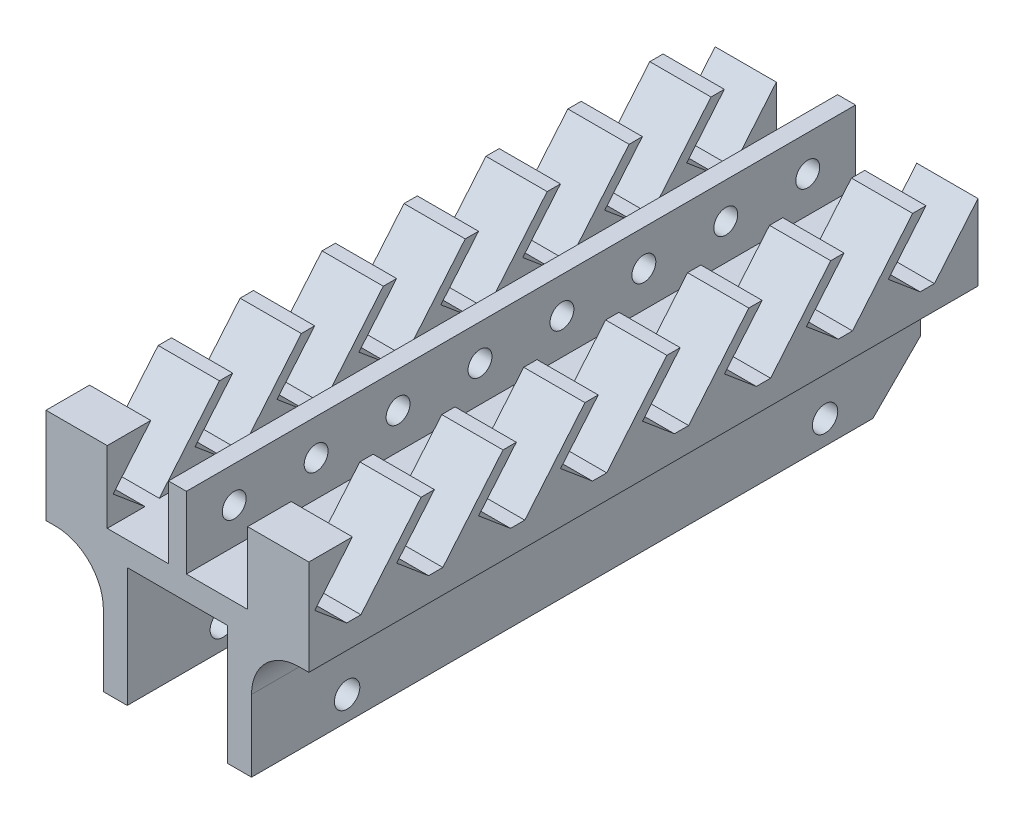
from build123d import *

# Parameters (mm, degrees)
BOSS_EXTRUDE1_DEPTH             = 88.9
F_1_4_CLEARANCE_HOLE1_D         = 6.7564
CHAMFER1_SIZE                   = 12.7
SKETCH8_W                       = 69.85
SKETCH8_H                       = 177.8
BOSS_EXTRUDE4_DEPTH             = 6.35
SKETCH4_W                       = 177.8
SKETCH4_H                       = 19.05
BOSS_EXTRUDE2_DEPTH             = 2.38125
F_1_4_0_25_DIAMETER_HOLE1_D     = 6.35
F_1_4_0_25_DIAMETER_HOLE1_DEPTH = 11.938
F_1_4_0_25_DIAMETER_HOLE1_TIP   = 1.907732465
FILLET3_R                       = 12.7
BOSS_EXTRUDE7_DEPTH             = 34.925
SKETCH31_W                      = 16.271875
SKETCH31_H                      = 19.05
CUT_EXTRUDE1_DEPTH              = 186.839234959


with BuildPart() as part:
    # Sketch1 → Boss-Extrude1 (new, symmetric)
    with BuildSketch(Plane.XY):
        Polygon((-19.685, 22.225), (19.685, 22.225), (19.685, -15.875), (13.335, -15.875), (13.335, 15.875), (-13.335, 15.875), (-13.335, -15.875), (-19.685, -15.875), align=None)
    extrude(amount=BOSS_EXTRUDE1_DEPTH, both=True)

    # 1/4 Clearance Hole1 (through all)
    with Locations(Plane(origin=(19.685, 0, 0), x_dir=(0, 0, -1), z_dir=(1, 0, 0))):
        with Locations((-63.5, -9.525), (63.5, -9.525)):
            Hole(F_1_4_CLEARANCE_HOLE1_D / 2)

    # Chamfer1
    chamfer1_edges = [part.edges().sort_by_distance(p)[0] for p in [
        (16.51, -15.875, -88.9),
        (-16.51, -15.875, -88.9),
    ]]
    chamfer(chamfer1_edges, length=CHAMFER1_SIZE)

    # Sketch8 → Boss-Extrude4 (add)
    with BuildSketch(Plane(origin=(0, 22.225, 0), x_dir=(1, 0, 0), z_dir=(0, 1, 0))):
        Rectangle(SKETCH8_W, SKETCH8_H)
    extrude(amount=-BOSS_EXTRUDE4_DEPTH)

    # Sketch4 → Boss-Extrude2 (add, symmetric)
    with BuildSketch(Plane(origin=(0, 0, 0), x_dir=(0, 0, -1), z_dir=(1, 0, 0))):
        with Locations((0, 31.75)):
            Rectangle(SKETCH4_W, SKETCH4_H)
    extrude(amount=BOSS_EXTRUDE2_DEPTH, both=True)

    # 1/4 (0.25) Diameter Hole1
    with Locations(Plane.ZY.offset(2.38125)):
        with Locations((-76.2, 31.75), (76.2, 31.75), (54.428571429, 31.75), (32.657142857, 31.75), (10.885714286, 31.75), (-10.885714286, 31.75), (-32.657142857, 31.75), (-54.428571429, 31.75)):
            Hole(F_1_4_0_25_DIAMETER_HOLE1_D / 2, depth=F_1_4_0_25_DIAMETER_HOLE1_DEPTH)
            with Locations((0, 0, -(F_1_4_0_25_DIAMETER_HOLE1_DEPTH + F_1_4_0_25_DIAMETER_HOLE1_TIP / 2))):  # 118° drill point
                Cone(0, F_1_4_0_25_DIAMETER_HOLE1_D / 2, F_1_4_0_25_DIAMETER_HOLE1_TIP, mode=Mode.SUBTRACT)

    # Fillet3
    fillet3_edges = [part.edges().sort_by_distance(p)[0] for p in [
        (19.685, 15.875, 0),
        (-19.685, 15.875, 0),
    ]]
    fillet(fillet3_edges, radius=FILLET3_R)

    # Sketch30 → Boss-Extrude7 (add, symmetric)
    with BuildSketch(Plane(origin=(0, 0, 0), x_dir=(0, 0, -1), z_dir=(1, 0, 0))):
        Polygon((-88.9, 41.275), (-88.9, 27.481460305), (-87.337897471, 29.343101606), (-77.325845929, 41.275), align=None)
        Polygon((-59.089306097, 41.275), (-75.074154071, 22.225), (-71.539265332, 22.225), (-65.566468899, 29.343101606), (-55.554417358, 41.275), align=None)
        Polygon((-37.317877526, 41.275), (-53.3027255, 22.225), (-49.76783676, 22.225), (-43.795040328, 29.343101606), (-33.782988786, 41.275), align=None)
        Polygon((-12.011560215, 41.275), (-15.546448954, 41.275), (-31.531296928, 22.225), (-27.996408189, 22.225), (-22.023611756, 29.343101606), align=None)
        Polygon((9.759868357, 41.275), (6.224979617, 41.275), (-9.759868357, 22.225), (-6.224979617, 22.225), (-0.252183185, 29.343101606), align=None)
        Polygon((31.531296928, 41.275), (27.996408189, 41.275), (12.011560215, 22.225), (15.546448954, 22.225), (21.519245386, 29.343101606), align=None)
        Polygon((53.3027255, 41.275), (49.76783676, 41.275), (33.782988786, 22.225), (37.317877526, 22.225), (43.290673958, 29.343101606), align=None)
        Polygon((75.074154071, 41.275), (71.539265332, 41.275), (55.554417358, 22.225), (59.089306097, 22.225), (65.062102529, 29.343101606), align=None)
        Polygon((-88.9, 27.481460305), (-88.9, 22.225), (-78.854874309, 22.225), (-87.337897471, 29.343101606), align=None)
        Polygon((-65.566468899, 29.343101606), (-71.539265332, 22.225), (-57.083445738, 22.225), align=None)
        Polygon((-43.795040328, 29.343101606), (-49.76783676, 22.225), (-35.312017166, 22.225), align=None)
        Polygon((-22.023611756, 29.343101606), (-27.996408189, 22.225), (-13.540588595, 22.225), align=None)
        Polygon((8.230839976, 22.225), (-0.252183185, 29.343101606), (-6.224979617, 22.225), align=None)
        Polygon((30.002268548, 22.225), (21.519245386, 29.343101606), (15.546448954, 22.225), align=None)
        Polygon((51.773697119, 22.225), (43.290673958, 29.343101606), (37.317877526, 22.225), align=None)
        Polygon((73.545125691, 22.225), (65.062102529, 29.343101606), (59.089306097, 22.225), align=None)
        Polygon((88.9, 22.225), (88.9, 36.018539695), (77.325845929, 22.225), align=None)
    extrude(amount=BOSS_EXTRUDE7_DEPTH, both=True)

    # Sketch31 → Cut-Extrude1 (cut, through all)
    with BuildSketch(Plane.XY.offset(88.9)):
        with Locations((10.5171875, 31.75)):
            Rectangle(SKETCH31_W, SKETCH31_H)
        with Locations((-10.5171875, 31.75)):
            Rectangle(SKETCH31_W, SKETCH31_H)
    extrude(amount=-CUT_EXTRUDE1_DEPTH, mode=Mode.SUBTRACT)


solid = part.part
